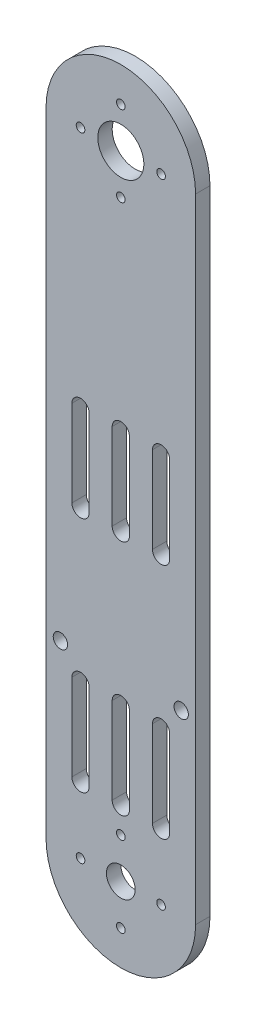
from build123d import *

# Parameters (mm, degrees)
SKETCH_1_R      = 5
SKETCH_1_R_2    = 1.5
SKETCH_1_R_3    = 8
SKETCH_1_R_4    = 2.5
EXTRUDE_1_DEPTH = 5


with BuildPart() as part:
    # 草图1 → 凸台-拉伸1 (new body)
    with BuildSketch(Plane.XY):
        with BuildLine():
            Line((-26, 220), (-26, 0))
            ThreePointArc((-26, 0), (0, -26), (26, 0))
            Line((26, 0), (26, 220))
            ThreePointArc((26, 220), (0, 246), (-26, 220))
        make_face()
        Circle(SKETCH_1_R, mode=Mode.SUBTRACT)
        with Locations((0, -14)):
            Circle(SKETCH_1_R_2, mode=Mode.SUBTRACT)
        with Locations(Location((0, 220, 0), (0, 0, 180))):
            Circle(SKETCH_1_R_3, mode=Mode.SUBTRACT)
        with Locations((-14, 0)):
            Circle(SKETCH_1_R_2, mode=Mode.SUBTRACT)
        with Locations((0, 14)):
            Circle(SKETCH_1_R_2, mode=Mode.SUBTRACT)
        with Locations((14, 0)):
            Circle(SKETCH_1_R_2, mode=Mode.SUBTRACT)
        with Locations((-21, 62)):
            Circle(SKETCH_1_R_4, mode=Mode.SUBTRACT)
        with Locations((21, 62)):
            Circle(SKETCH_1_R_4, mode=Mode.SUBTRACT)
        with Locations((0, 234)):
            Circle(SKETCH_1_R_2, mode=Mode.SUBTRACT)
        with Locations((14, 220)):
            Circle(SKETCH_1_R_2, mode=Mode.SUBTRACT)
        with Locations((0, 206)):
            Circle(SKETCH_1_R_2, mode=Mode.SUBTRACT)
        with Locations((-14, 220)):
            Circle(SKETCH_1_R_2, mode=Mode.SUBTRACT)
        with BuildLine():
            Line((-3, 23), (-3, 53))
            ThreePointArc((-3, 53), (0, 56), (3, 53))
            Line((3, 53), (3, 23))
            ThreePointArc((3, 23), (0, 20), (-3, 23))
        make_face(mode=Mode.SUBTRACT)
        with BuildLine():
            Line((-17, 23), (-17, 53))
            ThreePointArc((-17, 53), (-14, 56), (-11, 53))
            Line((-11, 53), (-11, 23))
            ThreePointArc((-11, 23), (-14, 20), (-17, 23))
        make_face(mode=Mode.SUBTRACT)
        with BuildLine():
            Line((17, 23), (17, 53))
            ThreePointArc((17, 53), (14, 56), (11, 53))
            Line((11, 53), (11, 23))
            ThreePointArc((11, 23), (14, 20), (17, 23))
        make_face(mode=Mode.SUBTRACT)
        with BuildLine():
            Line((-3, 105.5), (-3, 135.5))
            ThreePointArc((-3, 135.5), (0, 138.5), (3, 135.5))
            Line((3, 135.5), (3, 105.5))
            ThreePointArc((3, 105.5), (0, 102.5), (-3, 105.5))
        make_face(mode=Mode.SUBTRACT)
        with BuildLine():
            Line((-17, 105.5), (-17, 135.5))
            ThreePointArc((-17, 135.5), (-14, 138.5), (-11, 135.5))
            Line((-11, 135.5), (-11, 105.5))
            ThreePointArc((-11, 105.5), (-14, 102.5), (-17, 105.5))
        make_face(mode=Mode.SUBTRACT)
        with BuildLine():
            Line((17, 105.5), (17, 135.5))
            ThreePointArc((17, 135.5), (14, 138.5), (11, 135.5))
            Line((11, 135.5), (11, 105.5))
            ThreePointArc((11, 105.5), (14, 102.5), (17, 105.5))
        make_face(mode=Mode.SUBTRACT)
    extrude(amount=EXTRUDE_1_DEPTH)


solid = part.part
